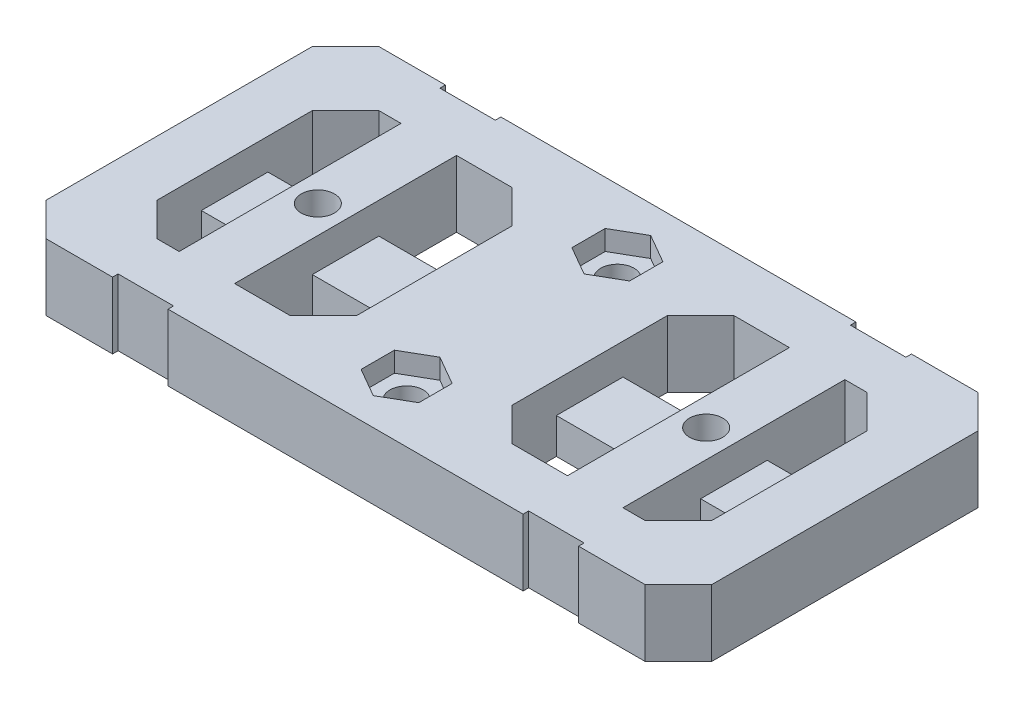
from build123d import *

# Parameters (mm, degrees)
SKETCH_1_W          = 60
SKETCH_1_H          = 30
SKETCH_1_W_2        = 18
SKETCH_1_H_2        = 20
SKETCH_1_R          = 1.5
EXTRUDE_1_DEPTH     = 3
CUT_EXTRUDE_START   = 1.2
SKETCH_1_3_R        = 1.5
CUT_EXTRUDE_1_DEPTH = 1.8
CHAMFER_1_SIZE      = 3
SKETCH_2_W          = 5
SKETCH_2_H          = 0.5
CUT_EXTRUDE_2_DEPTH = 34.674916481
SKETCH_3_W          = 5
SKETCH_3_H          = 20
SKETCH_3_R          = 1.5
EXTRUDE_2_DEPTH     = 3
SKETCH_4_R          = 2.75
SKETCH_4_W          = 14
SKETCH_4_H          = 3
EXTRUDE_3_DEPTH     = 3
EXTRUDE_START       = -0.2
EXTRUDE_4_DEPTH     = 0.2


with BuildPart() as part:
    # 스케치1 → 보스-돌출1 (new body)
    # profile 1 of 3: a face of its own
    with BuildSketch(Plane(origin=(0, 0, 0), x_dir=(1, 0, 0), z_dir=(0, 1, 0))):
        Rectangle(SKETCH_1_W, SKETCH_1_H)
        Polygon((2.6, 11.0011107), (0, 12.5022214), (-2.6, 11.0011107), (-2.6, 7.9988893), (0, 6.4977786), (2.6, 7.9988893), align=None, mode=Mode.SUBTRACT)
        Polygon((2.6, -7.9988893), (0, -6.4977786), (-2.6, -7.9988893), (-2.6, -11.0011107), (0, -12.5022214), (2.6, -11.0011107), align=None, mode=Mode.SUBTRACT)
        with Locations((-16, 0)):
            Rectangle(SKETCH_1_W_2, SKETCH_1_H_2, mode=Mode.SUBTRACT)
        with Locations((16, 0)):
            Rectangle(SKETCH_1_W_2, SKETCH_1_H_2, mode=Mode.SUBTRACT)
    # profile 2 of 3: a face of its own
    with BuildSketch(Plane(origin=(0, 0, 0), x_dir=(1, 0, 0), z_dir=(0, 1, 0))):
        Polygon((2.6, -11.0011107), (2.6, -7.9988893), (0, -6.4977786), (-2.6, -7.9988893), (-2.6, -11.0011107), (0, -12.5022214), align=None)
        with Locations(Location((0, -9.5, 0), (0, 0, 270))):
            Circle(SKETCH_1_R, mode=Mode.SUBTRACT)
    # profile 3 of 3: a face of its own
    with BuildSketch(Plane(origin=(0, 0, 0), x_dir=(1, 0, 0), z_dir=(0, 1, 0))):
        Polygon((2.6, 7.9988893), (2.6, 11.0011107), (0, 12.5022214), (-2.6, 11.0011107), (-2.6, 7.9988893), (0, 6.4977786), align=None)
        with Locations(Location((0, 9.5, 0), (0, 0, 270))):
            Circle(SKETCH_1_R, mode=Mode.SUBTRACT)
    extrude(amount=EXTRUDE_1_DEPTH)

    # 스케치1<3> → 컷-돌출1 (cut)
    # profile 1 of 2: a face of its own
    with BuildSketch(Plane(origin=(0, 0, 0), x_dir=(1, 0, 0), z_dir=(0, 1, 0)).offset(CUT_EXTRUDE_START)):
        Polygon((2.6, -11.0011107), (2.6, -7.9988893), (0, -6.4977786), (-2.6, -7.9988893), (-2.6, -11.0011107), (0, -12.5022214), align=None)
        with Locations(Location((0, -9.5, 0), (0, 0, 270))):
            Circle(SKETCH_1_3_R, mode=Mode.SUBTRACT)
    # profile 2 of 2: a face of its own
    with BuildSketch(Plane(origin=(0, 0, 0), x_dir=(1, 0, 0), z_dir=(0, 1, 0)).offset(CUT_EXTRUDE_START)):
        Polygon((2.6, 7.9988893), (2.6, 11.0011107), (0, 12.5022214), (-2.6, 11.0011107), (-2.6, 7.9988893), (0, 6.4977786), align=None)
        with Locations(Location((0, 9.5, 0), (0, 0, 270))):
            Circle(SKETCH_1_3_R, mode=Mode.SUBTRACT)
    extrude(amount=CUT_EXTRUDE_1_DEPTH, mode=Mode.SUBTRACT)

    # 모따기1
    chamfer_1_edges = [part.edges().sort_by_distance(p)[0] for p in [
        (25, 1.5, -10),
        (7, 1.5, -10),
        (7, 1.5, 10),
        (25, 1.5, 10),
        (-25, 1.5, -10),
        (-25, 1.5, 10),
        (-7, 1.5, 10),
        (-7, 1.5, -10),
        (-30, 1.5, 15),
        (-30, 1.5, -15),
        (30, 1.5, -15),
        (30, 1.5, 15),
    ]]
    chamfer(chamfer_1_edges, length=CHAMFER_1_SIZE)

    # 스케치2 → 컷-돌출2 (cut, through all)
    with BuildSketch(Plane(origin=(0, 3, 0), x_dir=(1, 0, 0), z_dir=(0, 1, 0))):
        with Locations((-18.5, -14.75)):
            Rectangle(SKETCH_2_W, SKETCH_2_H)
        with Locations((18.5, -14.75)):
            Rectangle(SKETCH_2_W, SKETCH_2_H)
        with Locations((18.5, 14.75)):
            Rectangle(SKETCH_2_W, SKETCH_2_H)
        with Locations((-18.5, 14.75)):
            Rectangle(SKETCH_2_W, SKETCH_2_H)
    extrude(amount=-CUT_EXTRUDE_2_DEPTH, mode=Mode.SUBTRACT)

    # 스케치3 → 보스-돌출2 (add)
    # profile 1 of 2: a face of its own
    with BuildSketch(Plane(origin=(0, 3, 0), x_dir=(1, 0, 0), z_dir=(0, 1, 0))):
        with Locations((-17.5, 0)):
            Rectangle(SKETCH_3_W, SKETCH_3_H)
        with Locations(Location((-17.5, 0, 0), (0, 0, 270))):
            Circle(SKETCH_3_R, mode=Mode.SUBTRACT)
    # profile 2 of 2: a face of its own
    with BuildSketch(Plane(origin=(0, 3, 0), x_dir=(1, 0, 0), z_dir=(0, 1, 0))):
        with Locations((17.5, 0)):
            Rectangle(SKETCH_3_W, SKETCH_3_H)
        with Locations(Location((17.5, 0, 0), (0, 0, 90))):
            Circle(SKETCH_3_R, mode=Mode.SUBTRACT)
    extrude(amount=-EXTRUDE_2_DEPTH)

    # 스케치4 → 보스-돌출3 (add)
    # profile 1 of 16: a face of its own
    with BuildSketch(Plane.XZ):
        Polygon((-25, 7), (-22, 10), (-20, 10), (-20, 3), (-15, 3), (-15, 10), (-10, 10), (-7, 7), (-7, 3), (7, 3), (7, 7), (10, 10), (15, 10), (15, 3), (20, 3), (20, 10), (22, 10), (25, 7), (25, 3), (25, 0), (30, 0), (30, 12), (27, 15), (21, 15), (21, 14.5), (16, 14.5), (16, 15), (-16, 15), (-16, 14.5), (-21, 14.5), (-21, 15), (-27, 15), (-30, 12), (-30, 0), (-25, 0), (-25, 3), align=None)
        with Locations(Location((0, 9.5, 0), (0, 0, 270))):
            Circle(SKETCH_4_R, mode=Mode.SUBTRACT)
    # profile 2 of 16: a face of its own
    with BuildSketch(Plane.XZ):
        Polygon((-25, -3), (-25, 0), (-30, 0), (-30, -12), (-27, -15), (-21, -15), (-21, -14.5), (-16, -14.5), (-16, -15), (16, -15), (16, -14.5), (21, -14.5), (21, -15), (27, -15), (30, -12), (30, 0), (25, 0), (25, -3), (25, -7), (22, -10), (20, -10), (20, -3), (15, -3), (15, -10), (10, -10), (7, -7), (7, -3), (-7, -3), (-7, -7), (-10, -10), (-15, -10), (-15, -3), (-20, -3), (-20, -10), (-22, -10), (-25, -7), align=None)
        with Locations(Location((0, -9.5, 0), (0, 0, 270))):
            Circle(SKETCH_4_R, mode=Mode.SUBTRACT)
    # profile 3 of 16: a face of its own
    with BuildSketch(Plane.XZ):
        with Locations((0, 1.5)):
            Rectangle(SKETCH_4_W, SKETCH_4_H)
    # profile 4 of 16: a face of its own
    with BuildSketch(Plane.XZ):
        with Locations((0, -1.5)):
            Rectangle(SKETCH_4_W, SKETCH_4_H)
    # profile 5 of 16: a face of its own
    with BuildSketch(Plane.XZ):
        with BuildLine():
            Line((-20, 1.145643924), (-20, 3))
            Line((-20, 3), (-25, 3))
            Line((-25, 3), (-25, 0))
            Line((-25, 0), (-20.25, 0))
            ThreePointArc((-20.25, 0), (-20.186773158, 0.58630197), (-20, 1.145643924))
        make_face()
    # profile 6 of 16: a face of its own
    with BuildSketch(Plane.XZ):
        with BuildLine():
            Line((-20.25, 0), (-25, 0))
            Line((-25, 0), (-25, -3))
            Line((-25, -3), (-20, -3))
            Line((-20, -3), (-20, -1.145643924))
            ThreePointArc((-20, -1.145643924), (-20.186773158, -0.58630197), (-20.25, 0))
        make_face()
    # profile 7 of 16: a face of its own
    with BuildSketch(Plane.XZ):
        with BuildLine():
            Line((-15, 3), (-20, 3))
            Line((-20, 3), (-20, 1.145643924))
            ThreePointArc((-20, 1.145643924), (-17.5, 2.75), (-15, 1.145643924))
            Line((-15, 1.145643924), (-15, 3))
        make_face()
    # profile 8 of 16: a face of its own
    with BuildSketch(Plane.XZ):
        with BuildLine():
            Line((-7, 3), (-15, 3))
            Line((-15, 3), (-15, 1.145643924))
            ThreePointArc((-15, 1.145643924), (-14.813226842, 0.58630197), (-14.75, 0))
            Line((-14.75, 0), (-7, 0))
            Line((-7, 0), (-7, 3))
        make_face()
    # profile 9 of 16: a face of its own
    with BuildSketch(Plane.XZ):
        with BuildLine():
            ThreePointArc((-15, -1.145643924), (-17.5, -2.75), (-20, -1.145643924))
            Line((-20, -1.145643924), (-20, -3))
            Line((-20, -3), (-15, -3))
            Line((-15, -3), (-15, -1.145643924))
        make_face()
    # profile 10 of 16: a face of its own
    with BuildSketch(Plane.XZ):
        with BuildLine():
            Line((-7, 0), (-14.75, 0))
            ThreePointArc((-14.75, 0), (-14.813226842, -0.58630197), (-15, -1.145643924))
            Line((-15, -1.145643924), (-15, -3))
            Line((-15, -3), (-7, -3))
            Line((-7, -3), (-7, 0))
        make_face()
    # profile 11 of 16: a face of its own
    with BuildSketch(Plane.XZ):
        with BuildLine():
            Line((15, 3), (7, 3))
            Line((7, 3), (7, 0))
            Line((7, 0), (14.75, 0))
            ThreePointArc((14.75, 0), (14.813226842, 0.58630197), (15, 1.145643924))
            Line((15, 1.145643924), (15, 3))
        make_face()
    # profile 12 of 16: a face of its own
    with BuildSketch(Plane.XZ):
        with BuildLine():
            Line((14.75, 0), (7, 0))
            Line((7, 0), (7, -3))
            Line((7, -3), (15, -3))
            Line((15, -3), (15, -1.145643924))
            ThreePointArc((15, -1.145643924), (14.813226842, -0.58630197), (14.75, 0))
        make_face()
    # profile 13 of 16: a face of its own
    with BuildSketch(Plane.XZ):
        with BuildLine():
            Line((20, 3), (15, 3))
            Line((15, 3), (15, 1.145643924))
            ThreePointArc((15, 1.145643924), (17.5, 2.75), (20, 1.145643924))
            Line((20, 1.145643924), (20, 3))
        make_face()
    # profile 14 of 16: a face of its own
    with BuildSketch(Plane.XZ):
        with BuildLine():
            Line((15, -1.145643924), (15, -3))
            Line((15, -3), (20, -3))
            Line((20, -3), (20, -1.145643924))
            ThreePointArc((20, -1.145643924), (17.5, -2.75), (15, -1.145643924))
        make_face()
    # profile 15 of 16: a face of its own
    with BuildSketch(Plane.XZ):
        with BuildLine():
            Line((20, -1.145643924), (20, -3))
            Line((20, -3), (25, -3))
            Line((25, -3), (25, 0))
            Line((25, 0), (20.25, 0))
            ThreePointArc((20.25, 0), (20.186773158, -0.58630197), (20, -1.145643924))
        make_face()
    # profile 16 of 16: a face of its own
    with BuildSketch(Plane.XZ):
        with BuildLine():
            Line((25, 3), (20, 3))
            Line((20, 3), (20, 1.145643924))
            ThreePointArc((20, 1.145643924), (20.186773158, 0.58630197), (20.25, 0))
            Line((20.25, 0), (25, 0))
            Line((25, 0), (25, 3))
        make_face()
    extrude(amount=EXTRUDE_3_DEPTH)

    # 스케치4<3> → 보스-돌출4 (add)
    with BuildSketch(Plane.XZ.offset(EXTRUDE_START)):
        with BuildLine():
            ThreePointArc((20.25, 0), (20.186773158, 0.58630197), (20, 1.145643924))
            Line((20, 1.145643924), (20, 0))
            Line((20, 0), (20.25, 0))
        make_face()
        with BuildLine():
            Line((20, 0), (20, -1.145643924))
            ThreePointArc((20, -1.145643924), (20.186773158, -0.58630197), (20.25, 0))
            Line((20.25, 0), (20, 0))
        make_face()
        with BuildLine():
            Line((20, -1.145643924), (20, -3))
            Line((20, -3), (25, -3))
            Line((25, -3), (25, 0))
            Line((25, 0), (20.25, 0))
            ThreePointArc((20.25, 0), (20.186773158, -0.58630197), (20, -1.145643924))
        make_face()
        with BuildLine():
            Line((25, 3), (20, 3))
            Line((20, 3), (20, 1.145643924))
            ThreePointArc((20, 1.145643924), (20.186773158, 0.58630197), (20.25, 0))
            Line((20.25, 0), (25, 0))
            Line((25, 0), (25, 3))
        make_face()
        with BuildLine():
            ThreePointArc((15, 1.145643924), (14.813226842, 0.58630197), (14.75, 0))
            Line((14.75, 0), (15, 0))
            Line((15, 0), (15, 1.145643924))
        make_face()
        with BuildLine():
            Line((15, 0), (14.75, 0))
            ThreePointArc((14.75, 0), (14.813226842, -0.58630197), (15, -1.145643924))
            Line((15, -1.145643924), (15, 0))
        make_face()
        with BuildLine():
            Line((14.75, 0), (7, 0))
            Line((7, 0), (7, -3))
            Line((7, -3), (15, -3))
            Line((15, -3), (15, -1.145643924))
            ThreePointArc((15, -1.145643924), (14.813226842, -0.58630197), (14.75, 0))
        make_face()
        with BuildLine():
            Line((15, 3), (7, 3))
            Line((7, 3), (7, 0))
            Line((7, 0), (14.75, 0))
            ThreePointArc((14.75, 0), (14.813226842, 0.58630197), (15, 1.145643924))
            Line((15, 1.145643924), (15, 3))
        make_face()
        with BuildLine():
            Line((-20, 0), (-20, 1.145643924))
            ThreePointArc((-20, 1.145643924), (-20.186773158, 0.58630197), (-20.25, 0))
            Line((-20.25, 0), (-20, 0))
        make_face()
        with BuildLine():
            Line((-20, -1.145643924), (-20, 0))
            Line((-20, 0), (-20.25, 0))
            ThreePointArc((-20.25, 0), (-20.186773158, -0.58630197), (-20, -1.145643924))
        make_face()
        with BuildLine():
            Line((-20.25, 0), (-25, 0))
            Line((-25, 0), (-25, -3))
            Line((-25, -3), (-20, -3))
            Line((-20, -3), (-20, -1.145643924))
            ThreePointArc((-20, -1.145643924), (-20.186773158, -0.58630197), (-20.25, 0))
        make_face()
        with BuildLine():
            Line((-20, 1.145643924), (-20, 3))
            Line((-20, 3), (-25, 3))
            Line((-25, 3), (-25, 0))
            Line((-25, 0), (-20.25, 0))
            ThreePointArc((-20.25, 0), (-20.186773158, 0.58630197), (-20, 1.145643924))
        make_face()
        with BuildLine():
            Line((-7, 3), (-15, 3))
            Line((-15, 3), (-15, 1.145643924))
            ThreePointArc((-15, 1.145643924), (-14.813226842, 0.58630197), (-14.75, 0))
            Line((-14.75, 0), (-7, 0))
            Line((-7, 0), (-7, 3))
        make_face()
        with BuildLine():
            Line((-7, 0), (-14.75, 0))
            ThreePointArc((-14.75, 0), (-14.813226842, -0.58630197), (-15, -1.145643924))
            Line((-15, -1.145643924), (-15, -3))
            Line((-15, -3), (-7, -3))
            Line((-7, -3), (-7, 0))
        make_face()
        with BuildLine():
            ThreePointArc((-14.75, 0), (-14.813226842, 0.58630197), (-15, 1.145643924))
            Line((-15, 1.145643924), (-15, 0))
            Line((-15, 0), (-14.75, 0))
        make_face()
        with BuildLine():
            Line((-14.75, 0), (-15, 0))
            Line((-15, 0), (-15, -1.145643924))
            ThreePointArc((-15, -1.145643924), (-14.813226842, -0.58630197), (-14.75, 0))
        make_face()
    extrude(amount=EXTRUDE_4_DEPTH)


solid = part.part
